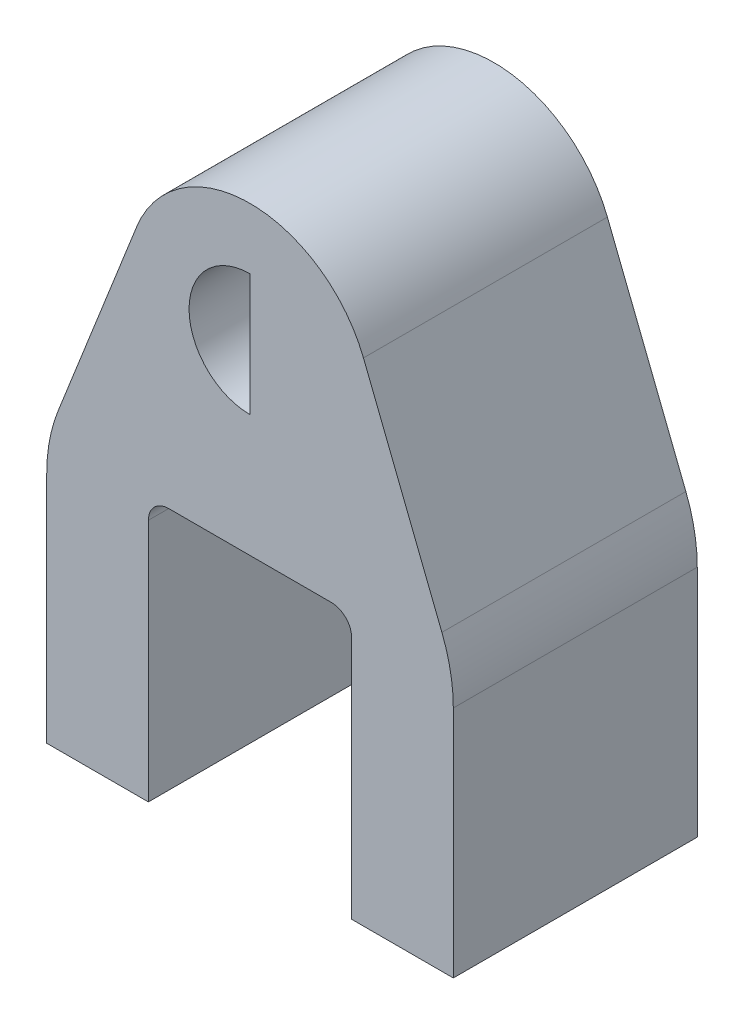
from build123d import *

# Parameters (mm, degrees)
BOSS_EXTRUDE1_DEPTH = 19.05


with BuildPart() as part:
    # Sketch1 → Boss-Extrude1 (new, symmetric)
    with BuildSketch(Plane.XY):
        with BuildLine():
            Line((-12.7, 8.528712184), (0, 8.528712184))
            Line((0, 8.528712184), (12.7, 8.528712184))
            ThreePointArc((12.7, 8.528712184), (14.94506403, 7.598776215), (15.875, 5.353712184))
            Line((15.875, 5.353712184), (15.875, -32.746287816))
            Line((15.875, -32.746287816), (31.75, -32.746287816))
            Line((31.75, -32.746287816), (31.75, 3.774872893))
            ThreePointArc((31.75, 3.774872893), (31.301172558, 8.528712184), (29.970552126, 13.11454726))
            Line((29.970552126, 13.11454726), (17.715414094, 44.108467959))
            ThreePointArc((17.715414094, 44.108467959), (0, 56.153712184), (-17.715414094, 44.108467959))
            Line((-17.715414094, 44.108467959), (-29.970552126, 13.11454726))
            ThreePointArc((-29.970552126, 13.11454726), (-31.301172558, 8.528712184), (-31.75, 3.774872893))
            Line((-31.75, 3.774872893), (-31.75, -32.746287816))
            Line((-31.75, -32.746287816), (-15.875, -32.746287816))
            Line((-15.875, -32.746287816), (-15.875, 5.353712184))
            ThreePointArc((-15.875, 5.353712184), (-14.94506403, 7.598776215), (-12.7, 8.528712184))
        make_face()
        with BuildLine():
            Line((0, 46.628712184), (0, 27.578712184))
            ThreePointArc((0, 27.578712184), (-9.525, 37.103712184), (0, 46.628712184))
        make_face(mode=Mode.SUBTRACT)
    extrude(amount=BOSS_EXTRUDE1_DEPTH, both=True)


solid = part.part
